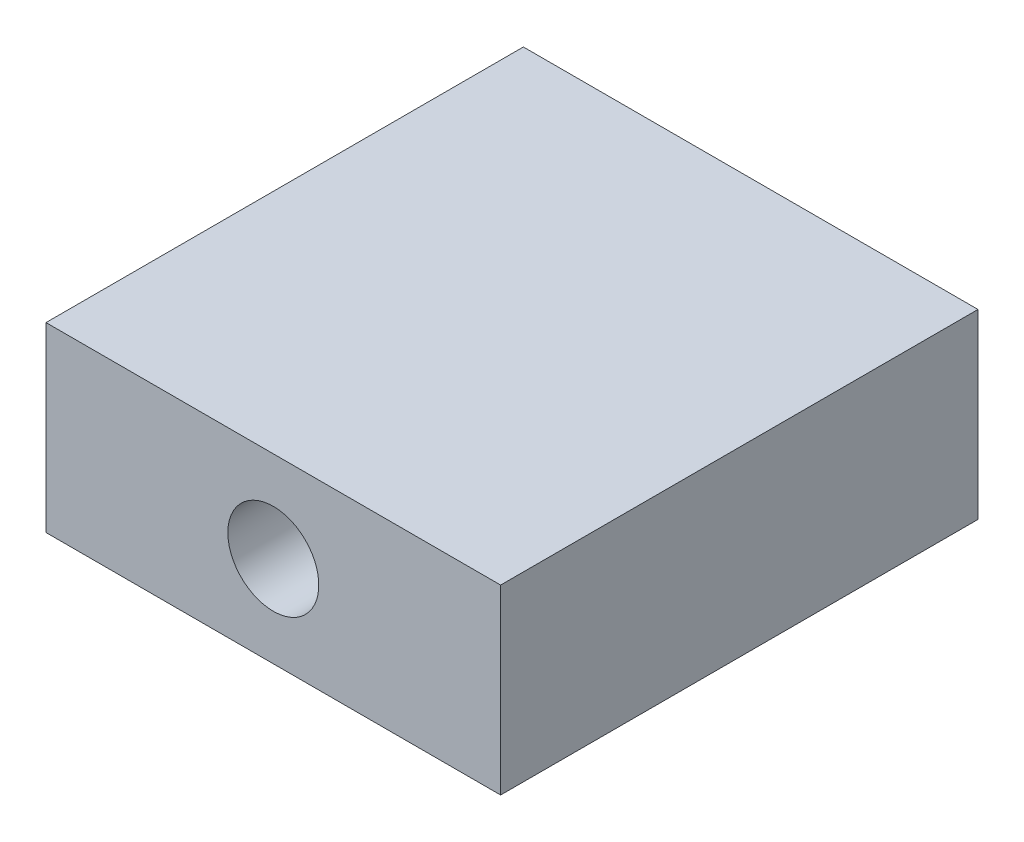
from build123d import *

# Parameters (mm, degrees)
SKETCH1_W           = 20
SKETCH1_H           = 8
SKETCH1_R           = 2
BOSS_EXTRUDE1_DEPTH = 21


with BuildPart() as part:
    # Sketch1 → Boss-Extrude1 (new body)
    with BuildSketch(Plane.XY):
        with Locations((10, -4)):
            Rectangle(SKETCH1_W, SKETCH1_H)
        with Locations(Location((10, -4, 0), (0, 0, 180))):
            Circle(SKETCH1_R, mode=Mode.SUBTRACT)
    extrude(amount=BOSS_EXTRUDE1_DEPTH)


solid = part.part
